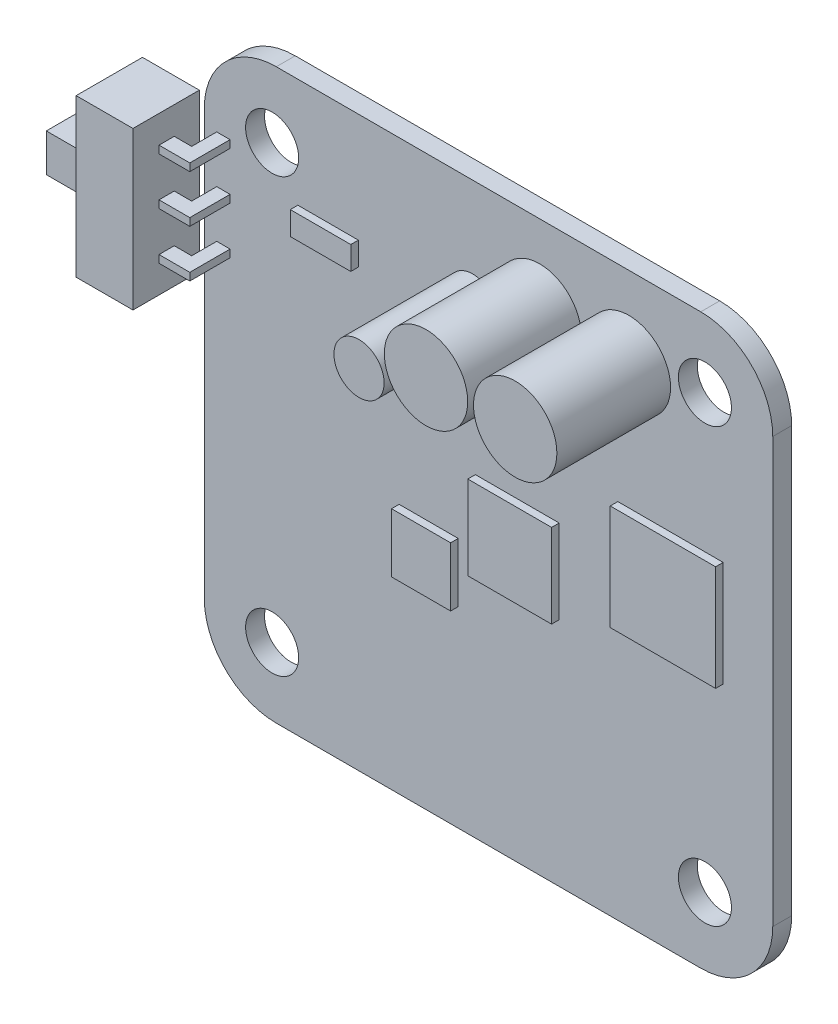
from build123d import *

# Parameters (mm, degrees)
ESBO_O1_W                = 30
ESBO_O1_H                = 30
ESBO_O1_R                = 1.4
RESSALTO_EXTRUS_O1_DEPTH = 1
FILETE1_R                = 3.8
ESBO_O2_W                = 4.42271784
ESBO_O2_H                = 4.422717839
ESBO_O2_W_2              = 3.118013776
ESBO_O2_H_2              = 3.118013775
ESBO_O2_W_3              = 5.559988141
ESBO_O2_H_3              = 5.559988141
ESBO_O2_W_4              = 3.193182952
ESBO_O2_H_4              = 1.233032197
RESSALTO_EXTRUS_O2_DEPTH = 0.4
RESSALTO_EXTRUS_O3_DEPTH = 3.5
ESBO_O4_R                = 2.2
ESBO_O4_R_2              = 1.324395516
RESSALTO_EXTRUS_O4_DEPTH = 6
ESBO_O6_W                = 1.838073738
ESBO_O6_H                = 1.373869438
ESBO_O6_W_2              = 0.919036869
ESBO_O6_H_2              = 1.323006201
ESBO_O6_W_3              = 2.325217377
ESBO_O6_H_3              = 0.75
CORTE_EXTRUS_O1_DEPTH    = 10


with BuildPart() as part:
    # Esboço1 → Ressalto-extrusão1 (new body)
    with BuildSketch(Plane.XY):
        Rectangle(ESBO_O1_W, ESBO_O1_H)
        with Locations((-11.42, 11.42)):
            Circle(ESBO_O1_R, mode=Mode.SUBTRACT)
        with Locations(Location((11.42, 11.42, 0), (0, 0, 180))):
            Circle(ESBO_O1_R, mode=Mode.SUBTRACT)
        with Locations((11.42, -11.42)):
            Circle(ESBO_O1_R, mode=Mode.SUBTRACT)
        with Locations(Location((-11.42, -11.42, 0), (0, 0, 180))):
            Circle(ESBO_O1_R, mode=Mode.SUBTRACT)
    extrude(amount=RESSALTO_EXTRUS_O1_DEPTH)

    # Filete1
    filete1_edges = [part.edges().sort_by_distance(p)[0] for p in [
        (15, -15, 0.5),
        (-15, -15, 0.5),
        (-15, 15, 0.5),
        (15, 15, 0.5),
    ]]
    fillet(filete1_edges, radius=FILETE1_R)

    # Esboço2 → Ressalto-extrusão2 (add)
    with BuildSketch(Plane.XY.offset(1)):
        with Locations((1.516360402, -0.600225993)):
            Rectangle(ESBO_O2_W, ESBO_O2_H)
        with Locations((-3.159084171, -3.31703838)):
            Rectangle(ESBO_O2_W_2, ESBO_O2_H_2)
        with Locations((9.60361588, 1.358406194)):
            Rectangle(ESBO_O2_W_3, ESBO_O2_H_3)
        with Locations((-8.466345578, 8.624299786)):
            Rectangle(ESBO_O2_W_4, ESBO_O2_H_4)
    extrude(amount=RESSALTO_EXTRUS_O2_DEPTH)

    # Esboço4 → Ressalto-extrusão4 (add)
    with BuildSketch(Plane.XY.offset(1)):
        with Locations((7.40686854, 10.742100478)):
            Circle(ESBO_O4_R)
        with Locations((2.70119832, 10.742100478)):
            Circle(ESBO_O4_R)
        with Locations((-0.833755816, 9.389590058)):
            Circle(ESBO_O4_R_2)
    extrude(amount=RESSALTO_EXTRUS_O4_DEPTH)


with BuildPart() as body_2:
    # Esboço3 → Ressalto-extrusão3 (new body)
    with BuildSketch(Plane.XY.offset(1)):
        Polygon((-18.262555034, 11.898651044), (-15.262555034, 11.898651044), (-15.262555034, 10.448651044), (-13.638595921, 10.448651044), (-13.638595921, 10.048651044), (-15.262555034, 10.048651044), (-15.262555034, 7.948651044), (-13.638595921, 7.948651044), (-13.638595921, 7.548651044), (-15.262555034, 7.548651044), (-15.262555034, 5.448651044), (-13.638595921, 5.448651044), (-13.638595921, 5.048651044), (-15.262555034, 5.048651044), (-15.262555034, 3.598651044), (-18.262555034, 3.598651044), (-18.262555034, 6.748651044), (-20.587772411, 6.748651044), (-20.587772411, 8.748651044), (-18.262555034, 8.748651044), align=None)
    extrude(amount=RESSALTO_EXTRUS_O3_DEPTH)

    # Esboço6 → Corte-extrusão1 (cut)
    with BuildSketch(Plane.XZ.offset(-3.598651044)):
        with Locations((-14.343518165, 3.813065281)):
            Rectangle(ESBO_O6_W, ESBO_O6_H)
        with Locations((-14.8030366, 1.661503101)):
            Rectangle(ESBO_O6_W_2, ESBO_O6_H_2)
        with Locations((-19.425163723, 4.125)):
            Rectangle(ESBO_O6_W_3, ESBO_O6_H_3)
        with Locations((-19.425163723, 1.375)):
            Rectangle(ESBO_O6_W_3, ESBO_O6_H_3)
    extrude(amount=-CORTE_EXTRUS_O1_DEPTH, mode=Mode.SUBTRACT)


solid = Compound([part.part, body_2.part])
